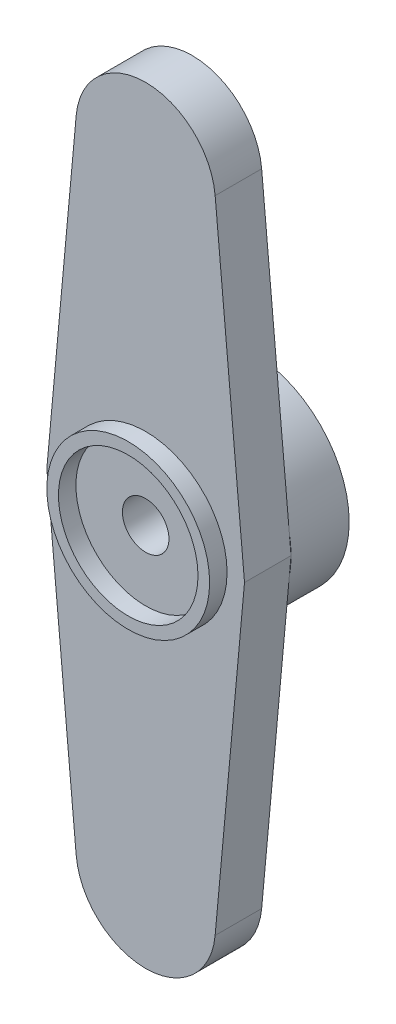
from build123d import *

# Parameters (mm, degrees)
SKETCH1_R           = 4.25
SKETCH1_R_2         = 2.5
BOSS_EXTRUDE1_DEPTH = 2.5
SKETCH2_R           = 1
BOSS_EXTRUDE2_DEPTH = 2
SKETCH3_R           = 3.5
SKETCH3_R_2         = 3
BOSS_EXTRUDE3_DEPTH = 0.75


with BuildPart() as part:
    # Sketch1 → Boss-Extrude1 (new body)
    with BuildSketch(Plane(origin=(0, 0, 0), x_dir=(0, 1, 0), z_dir=(0, 0, 1))):
        with Locations(Location((0, 0, 0), (0, 0, 270))):
            Circle(SKETCH1_R)
        with Locations(Location((0, 0, 0), (0, 0, 270))):
            Circle(SKETCH1_R_2, mode=Mode.SUBTRACT)
    extrude(amount=BOSS_EXTRUDE1_DEPTH)

    # Sketch2 → Boss-Extrude2 (add)
    with BuildSketch(Plane.XY.offset(2.5)):
        with BuildLine():
            Line((-4.25, 0), (-2.987476248, 13.773835115))
            ThreePointArc((-2.987476248, 13.773835115), (0, 16.5), (2.987476248, 13.773835115))
            Line((2.987476248, 13.773835115), (4.25, 0))
            Line((4.25, 0), (2.987476248, -13.773835115))
            ThreePointArc((2.987476248, -13.773835115), (0, -16.5), (-2.987476248, -13.773835115))
            Line((-2.987476248, -13.773835115), (-4.25, 0))
        make_face()
        Circle(SKETCH2_R, mode=Mode.SUBTRACT)
    extrude(amount=BOSS_EXTRUDE2_DEPTH)

    # Sketch3 → Boss-Extrude3 (add)
    with BuildSketch(Plane.XY.offset(4.5)):
        Circle(SKETCH3_R)
        Circle(SKETCH3_R_2, mode=Mode.SUBTRACT)
    extrude(amount=BOSS_EXTRUDE3_DEPTH)


solid = part.part
